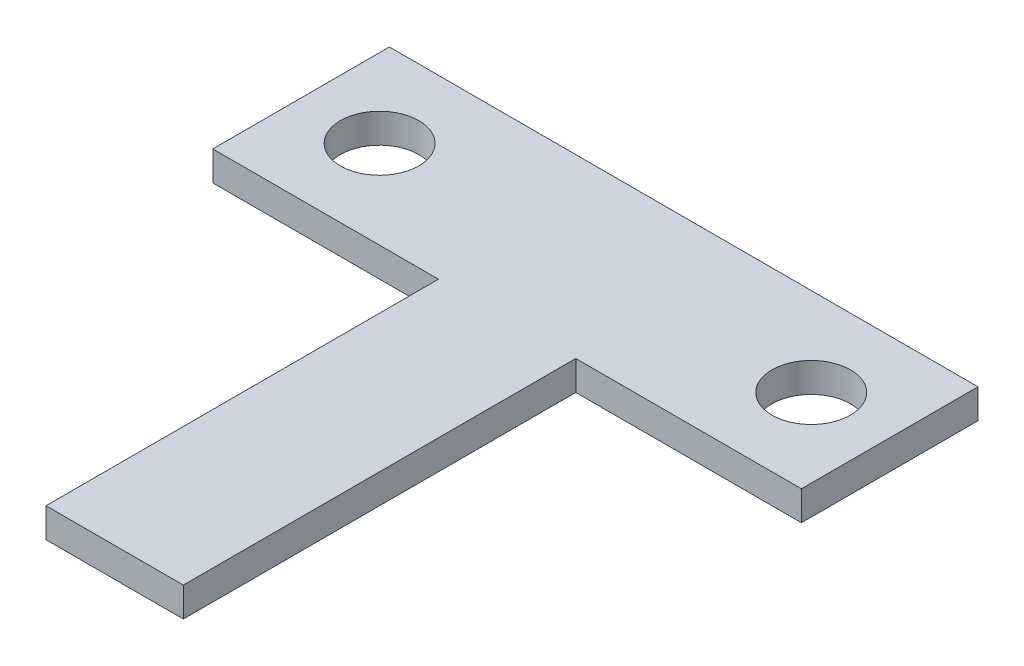
from build123d import *

# Parameters (mm, degrees)
ESBO_O1_R                = 2
RESSALTO_EXTRUS_O1_DEPTH = 1.5


with BuildPart() as part:
    # Esboço1 → Ressalto-extrusão1 (new body)
    with BuildSketch(Plane(origin=(0, 0, 0), x_dir=(1, 0, 0), z_dir=(0, 1, 0))):
        Polygon((-15, -4.5), (-15, 4.5), (15, 4.5), (15, -4.5), (3.5, -4.5), (3.5, -24.5), (-3.5, -24.5), (-3.5, -4.5), align=None)
        with Locations(Location((11, 0, 0), (0, 0, 270))):
            Circle(ESBO_O1_R, mode=Mode.SUBTRACT)
        with Locations(Location((-11, 0, 0), (0, 0, 90))):
            Circle(ESBO_O1_R, mode=Mode.SUBTRACT)
    extrude(amount=RESSALTO_EXTRUS_O1_DEPTH)


solid = part.part
